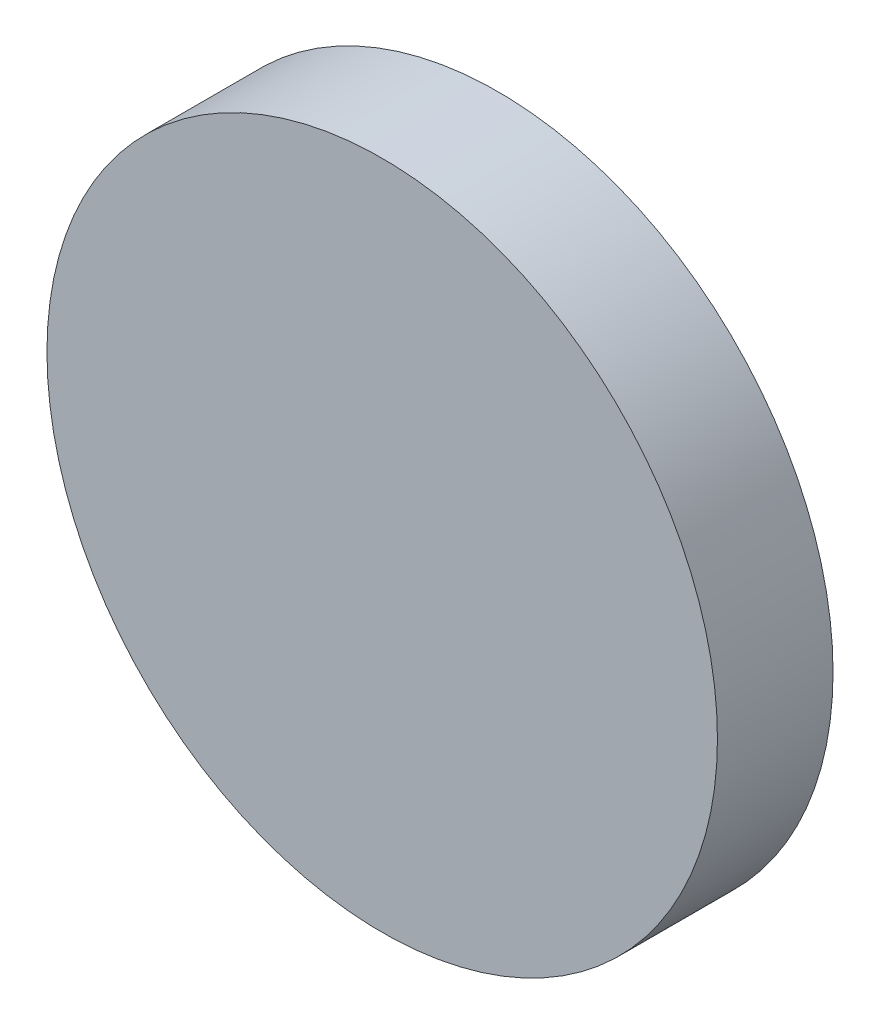
from build123d import *

# Parameters (mm, degrees)
SKETCH_1_R      = 29
EXTRUDE_1_DEPTH = 10


with BuildPart() as part:
    # 草图1 → 凸台-拉伸1 (new body)
    with BuildSketch(Plane.XY):
        Circle(SKETCH_1_R)
    extrude(amount=EXTRUDE_1_DEPTH)


solid = part.part
